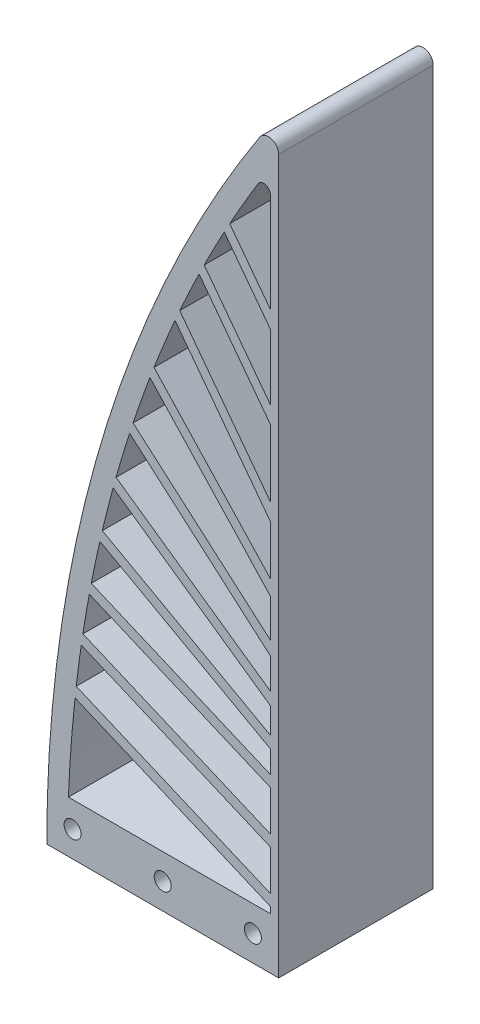
from build123d import *
from build123d.topology import SkipClean

# Parameters (mm, degrees)
BOSS_EXTRUDE4_DEPTH = 30
SKETCH12_R          = 1.65
CUT_EXTRUDE1_DEPTH  = 151.461734423
CUT_EXTRUDE2_START  = -20
CUT_EXTRUDE2_DEPTH  = 20
CUT_EXTRUDE3_START  = -30
CUT_EXTRUDE3_DEPTH  = 30
BOSS_EXTRUDE5_DEPTH = 30
CIRPATTERN1_COUNT   = 6
CIRPATTERN1_ANGLE   = 30
LPATTERN2_COUNT     = 3
LPATTERN2_PITCH     = 10
CUT_EXTRUDE4_START  = -30
CUT_EXTRUDE4_DEPTH  = 30
BOSS_EXTRUDE7_DEPTH = 30
LPATTERN3_COUNT     = 2
LPATTERN3_PITCH     = 16
CUT_EXTRUDE5_START  = -30
CUT_EXTRUDE5_DEPTH  = 30


with BuildPart() as part:
    # Sketch5 → Boss-Extrude4 (new body)
    with BuildSketch(Plane.XY):
        with BuildLine():
            Line((0, 0), (0, 138.405603612))
            ThreePointArc((0, 138.405603612), (-1.431938837, 140.323234054), (-3.677306515, 139.494934991))
            ThreePointArc((-3.677306515, 139.494934991), (-34.45212059, 72.743387818), (-45, 0))
            Line((-45, 0), (0, 0))
        make_face()
        with BuildLine():
            Line((-1.6, 10), (-40.801596678, 10))
            ThreePointArc((-40.801596678, 10), (-30.171322984, 73.09445494), (-4, 131.480881584))
            ThreePointArc((-4, 131.480881584), (-2.54422163, 132.052107892), (-1.6, 130.805498221))
            Line((-1.6, 130.805498221), (-1.6, 10))
        make_face(mode=Mode.SUBTRACT)
    extrude(amount=BOSS_EXTRUDE4_DEPTH)

    # Sketch12 → Cut-Extrude1 (cut, through all)
    with BuildSketch(Plane.XY.offset(30)):
        with Locations((-40, 5)):
            Circle(SKETCH12_R)
        with Locations((-22.5, 5)):
            Circle(SKETCH12_R)
        with Locations((-5, 5)):
            Circle(SKETCH12_R)
    extrude(amount=-CUT_EXTRUDE1_DEPTH, mode=Mode.SUBTRACT)

    # Sketch17 → Cut-Extrude2 (cut)
    with BuildSketch(Plane.XY.offset(30).offset(CUT_EXTRUDE2_START)):
        Polygon((-109.129206393, -31.174044695), (890.870793607, -18.386269912), (884.13367644, 508.454191469), (-120.638203698, 868.825955305), (-717.462714608, 272.001444394), align=None)
        with BuildLine():
            Line((-45, 0), (0, 0))
            Line((0, 0), (0, 138.405603612))
            ThreePointArc((0, 138.405603612), (-0.890765175, 140.069814567), (-2.769598102, 140.25160436))
            ThreePointArc((-2.769598102, 140.25160436), (-57.041683198, 80.109492203), (-45, 0))
        make_face(mode=Mode.SUBTRACT)
    extrude(amount=CUT_EXTRUDE2_DEPTH, mode=Mode.SUBTRACT)

    # Sketch18 → Cut-Extrude3 (cut)
    with BuildSketch(Plane.XY.offset(30).offset(CUT_EXTRUDE3_START)):
        Polygon((10.567687301, -7.152622061), (26.572035637, 318.782087337), (-234.729728554, 306.471050155), (-205.798791176, -46.855716973), align=None)
        with BuildLine():
            Line((-45, 0), (0, 0))
            Line((0, 0), (0, 138.405603612))
            ThreePointArc((0, 138.405603612), (-1.431938837, 140.323234054), (-3.677306515, 139.494934991))
            ThreePointArc((-3.677306515, 139.494934991), (-34.45212059, 72.743387818), (-45, 0))
        make_face(mode=Mode.SUBTRACT)
    extrude(amount=CUT_EXTRUDE3_DEPTH, mode=Mode.SUBTRACT)

    # Sketch14 → Boss-Extrude5 (add)
    with BuildSketch(Plane.XY.offset(30)):
        Polygon((48.4, 10), (-108.88130356, 76.761952422), (-108.099841303, 78.602962129), (49.181462257, 11.841009707), align=None)
    boss_extrude5 = extrude(amount=-BOSS_EXTRUDE5_DEPTH)

    # CirPattern1: Boss-Extrude5 ×6 about axis
    cirpattern1_axis = Axis((49.181462257, 11.841009707, 0), (0, 0, -1))
    for i in range(1, CIRPATTERN1_COUNT):
        add(boss_extrude5.rotate(cirpattern1_axis, i * CIRPATTERN1_ANGLE / (CIRPATTERN1_COUNT - 1)))

    # LPattern2: Boss-Extrude5 ×3
    with Locations(*[(0, -i * LPATTERN2_PITCH, 0) for i in range(1, LPATTERN2_COUNT)]):
        add(boss_extrude5)

    # Sketch20 → Cut-Extrude4 (cut)
    with BuildSketch(Plane.XY.offset(30).offset(CUT_EXTRUDE4_START)):
        Polygon((77.475806055, -29.017161833), (-265.551297842, 6.523481062), (-137.36538358, 367.52057294), (154.147754773, 113.145409747), align=None)
        with BuildLine():
            Line((-45, 0), (0, 0))
            Line((0, 0), (0, 138.405603612))
            ThreePointArc((0, 138.405603612), (-1.431938837, 140.323234054), (-3.677306515, 139.494934991))
            ThreePointArc((-3.677306515, 139.494934991), (-34.45212059, 72.743387818), (-45, 0))
        make_face(mode=Mode.SUBTRACT)
    extrude(amount=CUT_EXTRUDE4_DEPTH, mode=Mode.SUBTRACT)

    # Sketch21 → Boss-Extrude7 (add)
    with BuildSketch(Plane.XY.offset(30)):
        Polygon((-1.6, 92.230286229), (-0.00272898, 93.433916276), (-24.075329906, 125.379336678), (-25.672600926, 124.175706631), align=None)
    boss_extrude7 = extrude(amount=-BOSS_EXTRUDE7_DEPTH)

    # LPattern3: Boss-Extrude7 ×2
    with Locations(*[(0, i * LPATTERN3_PITCH, 0) for i in range(1, LPATTERN3_COUNT)]):
        add(boss_extrude7)

    # Sketch22 → Cut-Extrude5 (cut)
    with SkipClean():  # the faces are left unmerged after this step: merging them gives an invalid solid
        with BuildSketch(Plane.XY.offset(30).offset(CUT_EXTRUDE5_START)):
            Polygon((-56.498976092, -6.715699617), (29.926379711, -13.421115154), (17.260594809, 198.668694776), (-109.397254213, 188.734745833), align=None)
            with BuildLine():
                Line((0, 138.405603612), (0, 0))
                Line((0, 0), (-45, 0))
                ThreePointArc((-45, 0), (-34.45212059, 72.743387818), (-3.677306515, 139.494934991))
                ThreePointArc((-3.677306515, 139.494934991), (-1.431938837, 140.323234054), (0, 138.405603612))
            make_face(mode=Mode.SUBTRACT)
        extrude(amount=CUT_EXTRUDE5_DEPTH, mode=Mode.SUBTRACT)


solid = part.part
